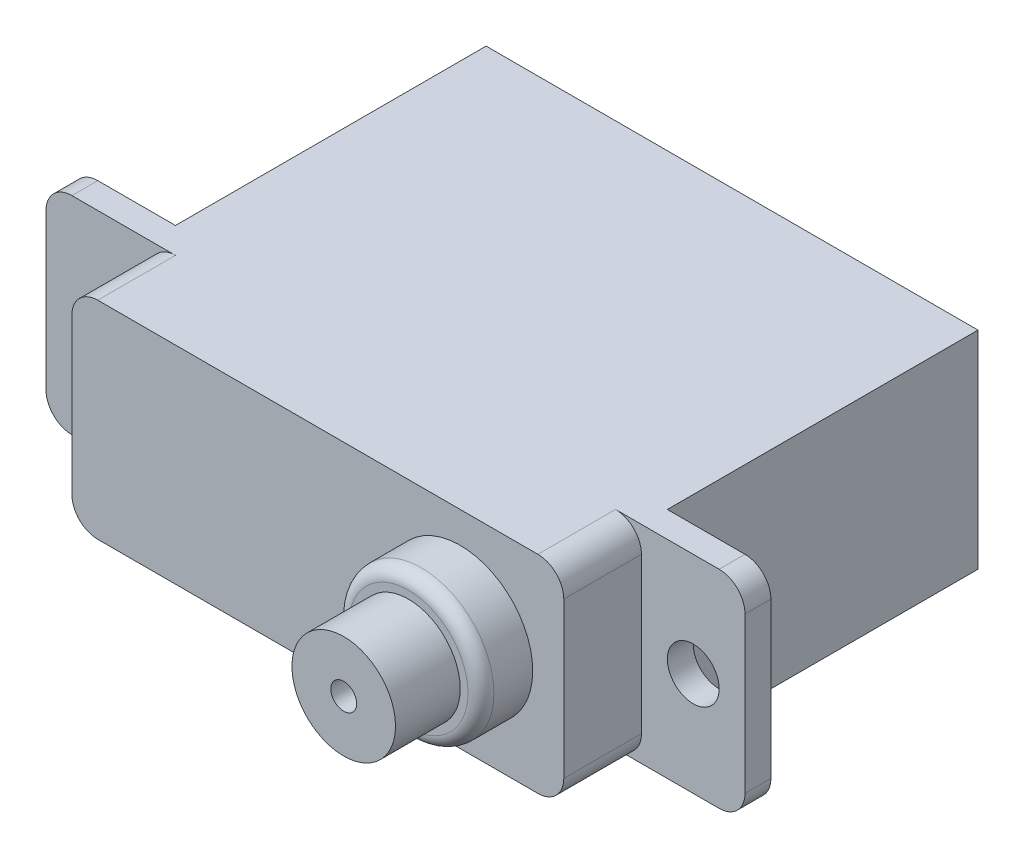
from build123d import *

# Parameters (mm, degrees)
IZIM1_W                     = 19
IZIM1_H                     = 8
Y_KSEKLIK_EKSTR_ZYON1_DEPTH = 12
IZIM2_R                     = 1
Y_KSEKLIK_EKSTR_ZYON2_DEPTH = 1
Y_KSEKLIK_EKSTR_ZYON3_DEPTH = 3
IZIM4_R                     = 2.8
Y_KSEKLIK_EKSTR_ZYON4_DEPTH = 2
IZIM5_R                     = 2
Y_KSEKLIK_EKSTR_ZYON5_DEPTH = 2.5
IZIM6_R                     = 0.5
KES_EKSTR_ZYON1_DEPTH       = 5
RADYUS1_R                   = 0.5


with BuildPart() as part:
    # Çizim1 → Yükseklik-Ekstrüzyon1 (new body)
    with BuildSketch(Plane.XY):
        Rectangle(IZIM1_W, IZIM1_H)
    extrude(amount=Y_KSEKLIK_EKSTR_ZYON1_DEPTH)

    # Çizim2 → Yükseklik-Ekstrüzyon2 (add)
    with BuildSketch(Plane.XY.offset(12)):
        with BuildLine():
            Line((-12.5, -4), (12.5, -4))
            ThreePointArc((12.5, -4), (13.207106781, -3.707106781), (13.5, -3))
            Line((13.5, -3), (13.5, 3))
            ThreePointArc((13.5, 3), (13.207106781, 3.707106781), (12.5, 4))
            Line((12.5, 4), (-12.5, 4))
            ThreePointArc((-12.5, 4), (-13.207106781, 3.707106781), (-13.5, 3))
            Line((-13.5, 3), (-13.5, -3))
            ThreePointArc((-13.5, -3), (-13.207106781, -3.707106781), (-12.5, -4))
        make_face()
        with Locations((-11.5, 0)):
            Circle(IZIM2_R, mode=Mode.SUBTRACT)
        with Locations((11.5, 0)):
            Circle(IZIM2_R, mode=Mode.SUBTRACT)
    extrude(amount=Y_KSEKLIK_EKSTR_ZYON2_DEPTH)

    # Çizim3 → Yükseklik-Ekstrüzyon3 (add)
    with BuildSketch(Plane.XY.offset(13)):
        with BuildLine():
            Line((-8.5, -4), (8.5, -4))
            ThreePointArc((8.5, -4), (9.207106781, -3.707106781), (9.5, -3))
            Line((9.5, -3), (9.5, 3))
            ThreePointArc((9.5, 3), (9.207106781, 3.707106781), (8.5, 4))
            Line((8.5, 4), (-8.5, 4))
            ThreePointArc((-8.5, 4), (-9.207106781, 3.707106781), (-9.5, 3))
            Line((-9.5, 3), (-9.5, -3))
            ThreePointArc((-9.5, -3), (-9.207106781, -3.707106781), (-8.5, -4))
        make_face()
    extrude(amount=Y_KSEKLIK_EKSTR_ZYON3_DEPTH)

    # Çizim4 → Yükseklik-Ekstrüzyon4 (add)
    with BuildSketch(Plane.XY.offset(16)):
        with Locations((5.5, 0)):
            Circle(IZIM4_R)
    extrude(amount=Y_KSEKLIK_EKSTR_ZYON4_DEPTH)

    # Çizim5 → Yükseklik-Ekstrüzyon5 (add)
    with BuildSketch(Plane.XY.offset(18)):
        with Locations((5.5, 0)):
            Circle(IZIM5_R)
    extrude(amount=Y_KSEKLIK_EKSTR_ZYON5_DEPTH)

    # Çizim6 → Kes-Ekstrüzyon1 (cut)
    with BuildSketch(Plane.XY.offset(20.5)):
        with Locations((5.5, 0)):
            Circle(IZIM6_R)
    extrude(amount=-KES_EKSTR_ZYON1_DEPTH, mode=Mode.SUBTRACT)

    # Radyus1
    radyus1_edges = [part.edges().sort_by_distance(p)[0] for p in [
        (2.7, 0, 18),
    ]]
    fillet(radyus1_edges, radius=RADYUS1_R)


solid = part.part
